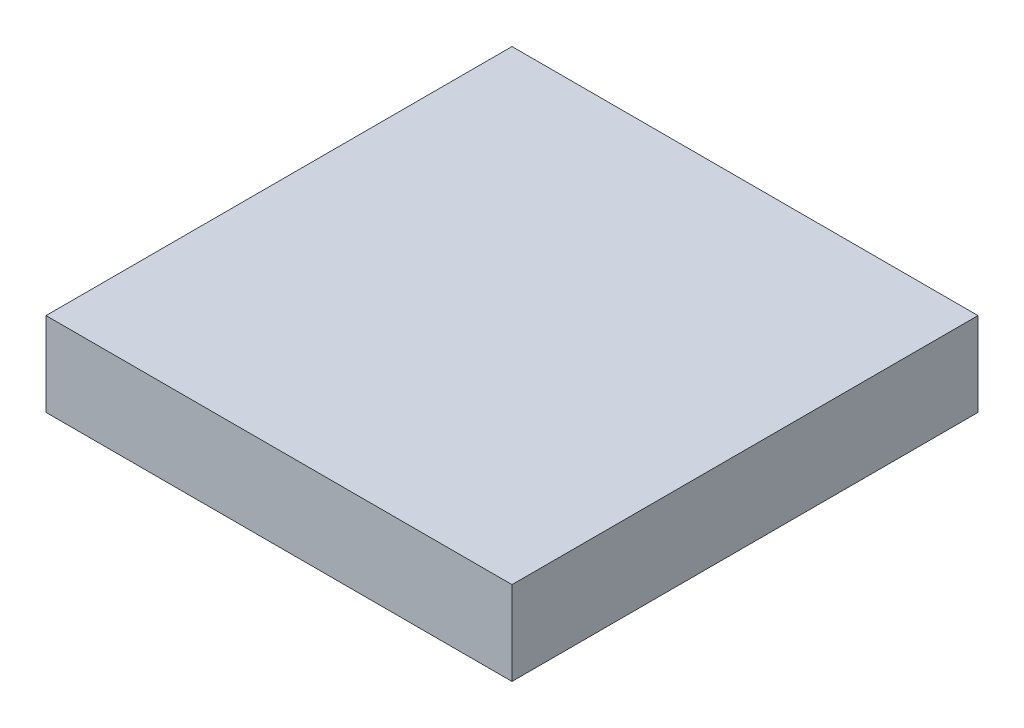
from build123d import *

# Parameters (mm, degrees)
IZIM1_W                     = 10
IZIM1_H                     = 10
Y_KSEKLIK_EKSTR_ZYON1_DEPTH = 1.8


with BuildPart() as part:
    # Çizim1 → Yükseklik-Ekstrüzyon1 (new body)
    with BuildSketch(Plane(origin=(0, 0, 0), x_dir=(1, 0, 0), z_dir=(0, 1, 0))):
        Rectangle(IZIM1_W, IZIM1_H)
    extrude(amount=Y_KSEKLIK_EKSTR_ZYON1_DEPTH)


solid = part.part
